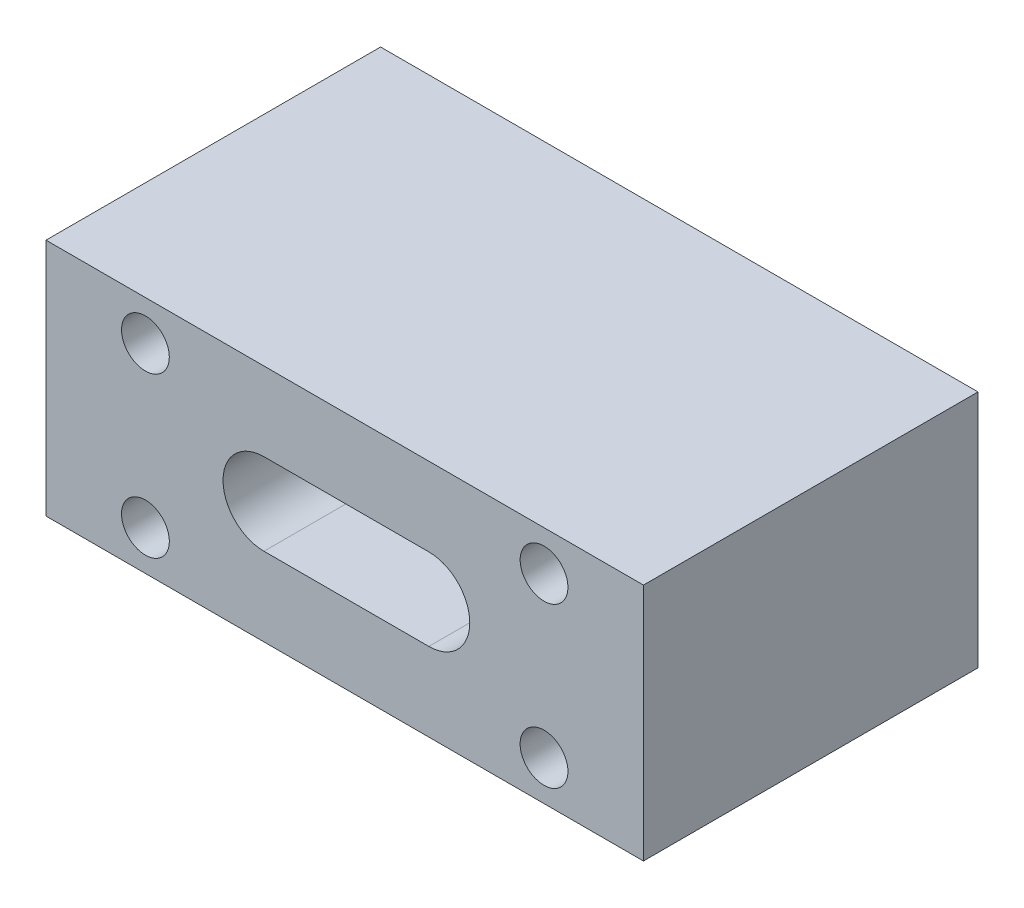
from build123d import *

# Parameters (mm, degrees)
ESQUISSE1_W        = 250
ESQUISSE1_H        = 100
ESQUISSE1_R        = 10
BOSS_EXTRU_1_DEPTH = 140


with BuildPart() as part:
    # Esquisse1 → Boss.-Extru.1 (new body)
    with BuildSketch(Plane.XY):
        Rectangle(ESQUISSE1_W, ESQUISSE1_H)
        with Locations((-83.402754161, 33.361101664)):
            Circle(ESQUISSE1_R, mode=Mode.SUBTRACT)
        with Locations(Location((83.402754161, 33.361101664, 0), (0, 0, 180))):
            Circle(ESQUISSE1_R, mode=Mode.SUBTRACT)
        with Locations((83.402754161, -33.361101664)):
            Circle(ESQUISSE1_R, mode=Mode.SUBTRACT)
        with Locations(Location((-83.402754161, -33.361101664, 0), (0, 0, 180))):
            Circle(ESQUISSE1_R, mode=Mode.SUBTRACT)
        with BuildLine():
            Line((-33.78724139, 17.132226308), (35.196852355, 17.132226308))
            ThreePointArc((35.196852355, 17.132226308), (52.329078664, 0), (35.196852355, -17.132226308))
            Line((35.196852355, -17.132226308), (-33.78724139, -17.132226308))
            ThreePointArc((-33.78724139, -17.132226308), (-50.919467698, 0), (-33.78724139, 17.132226308))
        make_face(mode=Mode.SUBTRACT)
    extrude(amount=BOSS_EXTRU_1_DEPTH)


solid = part.part
